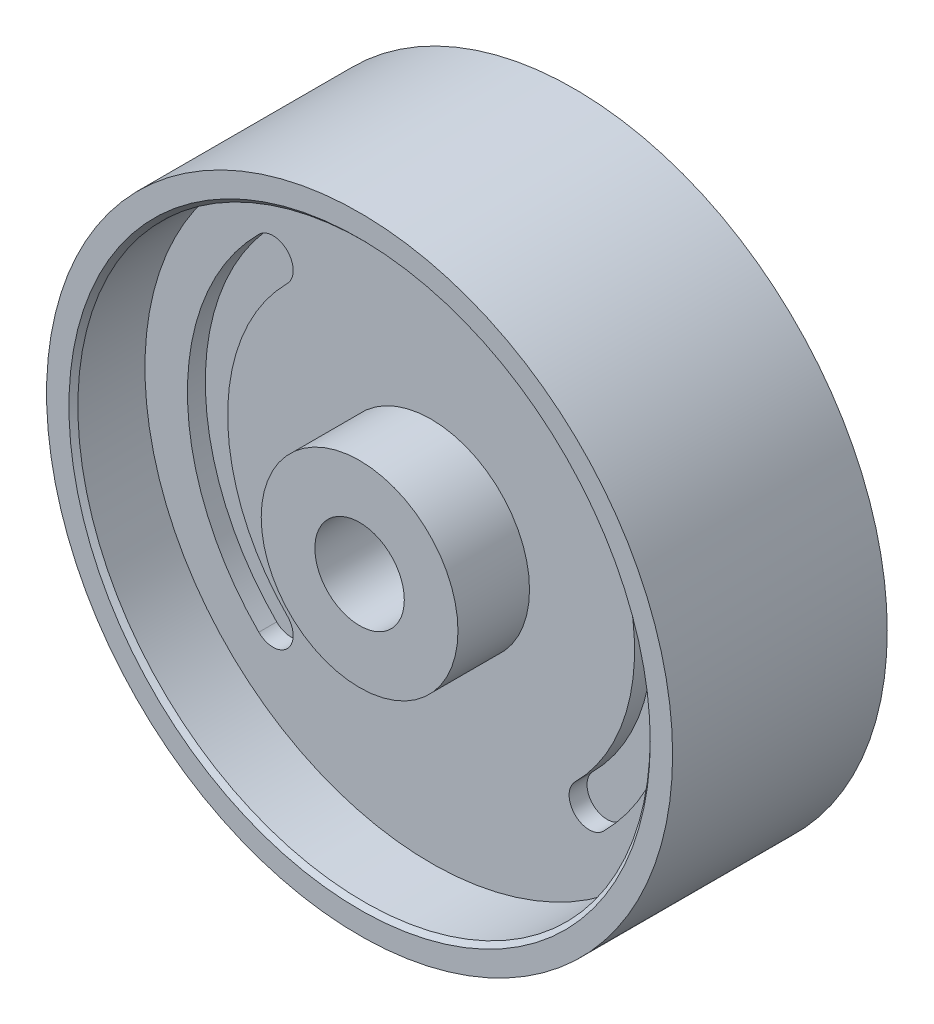
from build123d import *

# Parameters (mm, degrees)
SKETCH_1_R               = 35
EXTRUDE_1_DEPTH          = 12
CUT_EXTRUDE_1_DEPTH      = 51.931326313
CUT_EXTRUDE_1_DEPTH_BACK = 51.931326313
SKETCH_2_R               = 5
SKETCH_3_R               = 32
SKETCH_3_R_2             = 11
CUT_EXTRUDE_2_DEPTH      = 8
CUT_EXTRUDE_3_DEPTH      = 2
CHAMFER_1_SIZE           = 0.5


with BuildPart() as part:
    # 草图1 → 凸台-拉伸1 (new, symmetric)
    with BuildSketch(Plane.XY):
        Circle(SKETCH_1_R)
    extrude(amount=EXTRUDE_1_DEPTH, both=True)

    # 草图2 → 切除-拉伸1 (cut, two sides: drawn at the far end of the back side and taken through both)
    with BuildSketch(Plane.XY.offset(-CUT_EXTRUDE_1_DEPTH_BACK)):
        Circle(SKETCH_2_R)
    extrude(amount=CUT_EXTRUDE_1_DEPTH + CUT_EXTRUDE_1_DEPTH_BACK, mode=Mode.SUBTRACT)

    # 草图3 → 切除-拉伸2 (cut)
    with BuildSketch(Plane.XY.offset(12)):
        Circle(SKETCH_3_R)
        Circle(SKETCH_3_R_2, mode=Mode.SUBTRACT)
    cut_extrude_2 = extrude(amount=-CUT_EXTRUDE_2_DEPTH, mode=Mode.SUBTRACT)

    # 草图4 → 切除-拉伸3 (cut)
    with BuildSketch(Plane.XY.offset(4)):
        with BuildLine():
            ThreePointArc((-19.268659787, 19.268659787), (-27.25, 0), (-19.268659787, -19.268659787))
            ThreePointArc((-19.268659787, -19.268659787), (-16.086679272, -19.268659787), (-16.086679272, -16.086679272))
            ThreePointArc((-16.086679272, -16.086679272), (-22.75, 0), (-16.086679272, 16.086679272))
            ThreePointArc((-16.086679272, 16.086679272), (-16.086679272, 19.268659787), (-19.268659787, 19.268659787))
        make_face()
        with BuildLine():
            ThreePointArc((19.268659787, 19.268659787), (27.25, 0), (19.268659787, -19.268659787))
            ThreePointArc((19.268659787, -19.268659787), (16.086679272, -19.268659787), (16.086679272, -16.086679272))
            ThreePointArc((16.086679272, -16.086679272), (22.75, 0), (16.086679272, 16.086679272))
            ThreePointArc((16.086679272, 16.086679272), (16.086679272, 19.268659787), (19.268659787, 19.268659787))
        make_face()
    cut_extrude_3 = extrude(amount=-CUT_EXTRUDE_3_DEPTH, mode=Mode.SUBTRACT)

    # 镜向1: 切除-拉伸2, 切除-拉伸3 across plane
    add(cut_extrude_2.mirror(Plane.XY), mode=Mode.SUBTRACT)
    add(cut_extrude_3.mirror(Plane.XY), mode=Mode.SUBTRACT)

    # 倒角1
    chamfer_1_edges = [part.edges().sort_by_distance(p)[0] for p in [
        (-32, 0, 12),
        (-32, 0, -12),
    ]]
    chamfer(chamfer_1_edges, length=CHAMFER_1_SIZE)


solid = part.part
